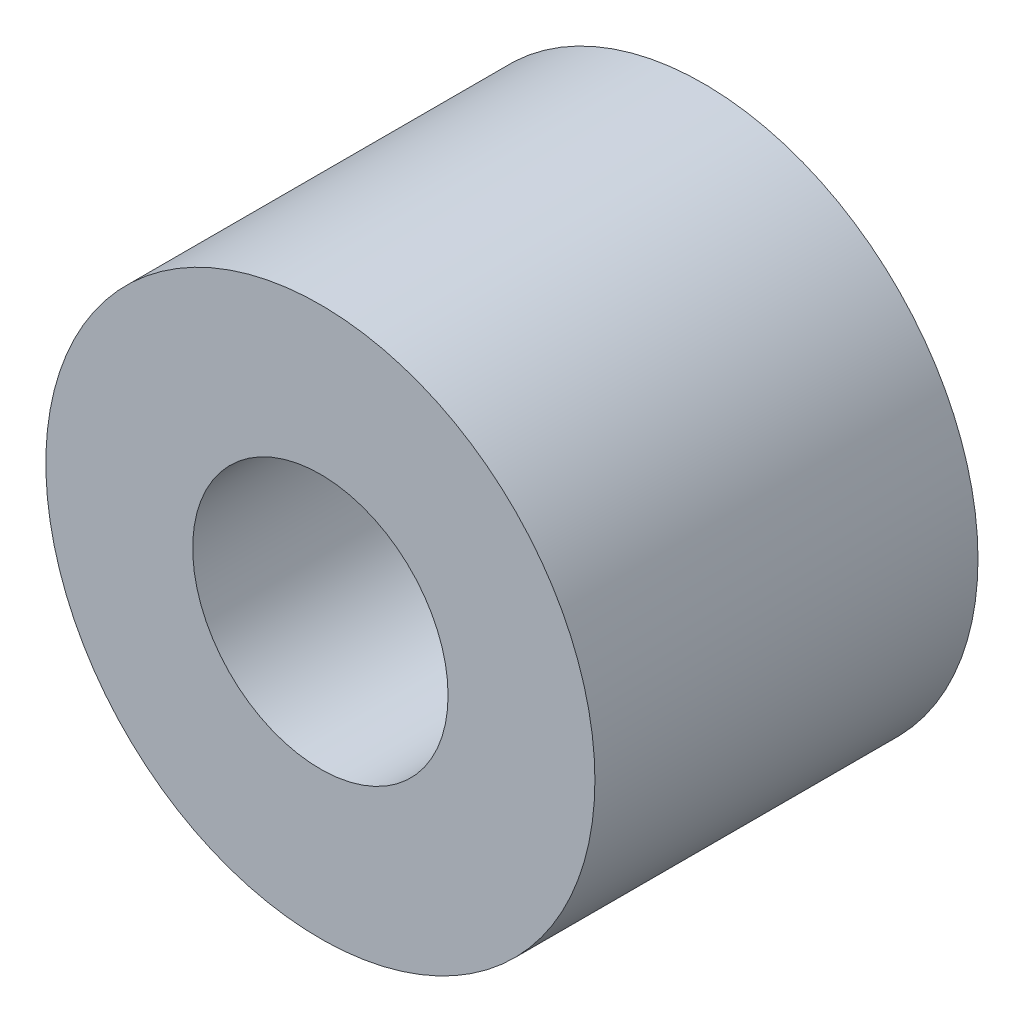
from build123d import *

# Parameters (mm, degrees)
SKETCH1_R           = 546.1
BOSS_EXTRUDE1_DEPTH = 762
SKETCH2_R           = 254
CUT_EXTRUDE1_DEPTH  = 1085.939823216


with BuildPart() as part:
    # Sketch1 → Boss-Extrude1 (new body)
    with BuildSketch(Plane.XY):
        Circle(SKETCH1_R)
    extrude(amount=BOSS_EXTRUDE1_DEPTH)

    # Sketch2 → Cut-Extrude1 (cut, through all)
    with BuildSketch(Plane.XY.offset(762)):
        Circle(SKETCH2_R)
    extrude(amount=-CUT_EXTRUDE1_DEPTH, mode=Mode.SUBTRACT)


solid = part.part
